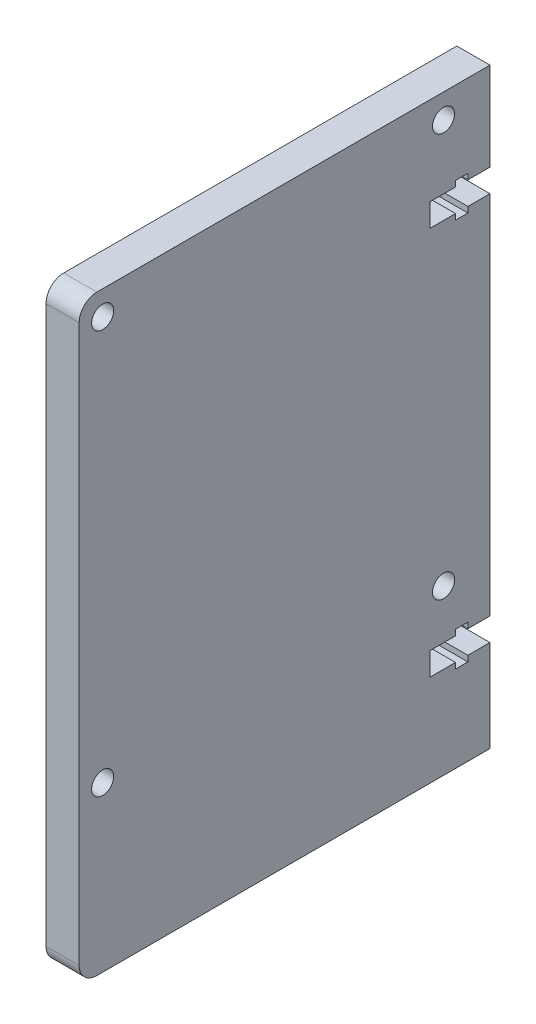
from build123d import *

# Parameters (mm, degrees)
SKETCH1_W           = 59.055
SKETCH1_H           = 85.09
BOSS_EXTRUDE1_DEPTH = 4.7625
CUT_EXTRUDE1_REACH  = 203.148
SKETCH2_R           = 1.5875
CUT_EXTRUDE2_DEPTH  = 202.147856386
FILLET1_R           = 2.54


with BuildPart() as part:
    # Sketch1 → Boss-Extrude1 (new body)
    with BuildSketch(Plane(origin=(0, 0, 0), x_dir=(0, 0, -1), z_dir=(1, 0, 0))):
        with Locations((-162.318935185, 17.727083333)):
            Rectangle(SKETCH1_W, SKETCH1_H)
    extrude(amount=BOSS_EXTRUDE1_DEPTH)

    # Sketch2 → Cut-Extrude1 (cut, up to next)
    with BuildSketch(Plane(origin=(4.7625, 0, 0), x_dir=(0, 0, -1), z_dir=(1, 0, 0)), mode=Mode.PRIVATE) as cut_extrude1_sk1:
        with Locations((-188.466435185, -1.227916667)):
            Circle(SKETCH2_R)
    cut_extrude1_tool1 = extrude(cut_extrude1_sk1.sketch, amount=-CUT_EXTRUDE1_REACH, mode=Mode.PRIVATE) & part.part
    # Sketch2 → Cut-Extrude1 (cut, up to next)
    with BuildSketch(Plane(origin=(4.7625, 0, 0), x_dir=(0, 0, -1), z_dir=(1, 0, 0)), mode=Mode.PRIVATE) as cut_extrude1_sk2:
        with Locations((-139.466435185, -1.227916667)):
            Circle(SKETCH2_R)
    cut_extrude1_tool2 = extrude(cut_extrude1_sk2.sketch, amount=-CUT_EXTRUDE1_REACH, mode=Mode.PRIVATE) & part.part
    # Sketch2 → Cut-Extrude1 (cut, up to next)
    with BuildSketch(Plane(origin=(4.7625, 0, 0), x_dir=(0, 0, -1), z_dir=(1, 0, 0)), mode=Mode.PRIVATE) as cut_extrude1_sk3:
        with Locations((-139.466435185, 56.772083333)):
            Circle(SKETCH2_R)
    cut_extrude1_tool3 = extrude(cut_extrude1_sk3.sketch, amount=-CUT_EXTRUDE1_REACH, mode=Mode.PRIVATE) & part.part
    # Sketch2 → Cut-Extrude1 (cut, up to next)
    with BuildSketch(Plane(origin=(4.7625, 0, 0), x_dir=(0, 0, -1), z_dir=(1, 0, 0)), mode=Mode.PRIVATE) as cut_extrude1_sk4:
        with Locations((-188.466435185, 56.772083333)):
            Circle(SKETCH2_R)
    cut_extrude1_tool4 = extrude(cut_extrude1_sk4.sketch, amount=-CUT_EXTRUDE1_REACH, mode=Mode.PRIVATE) & part.part
    add(cut_extrude1_tool1.solids().sort_by_distance((4.7625, -1.227917, 188.466435))[0], mode=Mode.SUBTRACT)
    add(cut_extrude1_tool2.solids().sort_by_distance((4.7625, -1.227917, 139.466435))[0], mode=Mode.SUBTRACT)
    add(cut_extrude1_tool3.solids().sort_by_distance((4.7625, 56.772083, 139.466435))[0], mode=Mode.SUBTRACT)
    add(cut_extrude1_tool4.solids().sort_by_distance((4.7625, 56.772083, 188.466435))[0], mode=Mode.SUBTRACT)

    # Sketch3 → Cut-Extrude2 (cut, through all)
    with BuildSketch(Plane.ZY):
        Polygon((132.791435185, 47.572083333), (135.966435185, 47.572083333), (135.966435185, 48.397583333), (137.744435185, 48.397583333), (137.744435185, 47.572083333), (141.427435185, 47.572083333), (141.427435185, 44.270083333), (137.744435185, 44.270083333), (137.744435185, 43.444583333), (135.966435185, 43.444583333), (135.966435185, 44.270083333), (132.791435185, 44.270083333), align=None)
        Polygon((132.791435185, -8.307916667), (135.966435185, -8.307916667), (135.966435185, -7.482416667), (137.744435185, -7.482416667), (137.744435185, -8.307916667), (141.427435185, -8.307916667), (141.427435185, -11.609916667), (137.744435185, -11.609916667), (137.744435185, -12.435416667), (135.966435185, -12.435416667), (135.966435185, -11.609916667), (132.791435185, -11.609916667), align=None)
    extrude(amount=-CUT_EXTRUDE2_DEPTH, mode=Mode.SUBTRACT)

    # Fillet1
    fillet1_edges = [part.edges().sort_by_distance(p)[0] for p in [
        (2.38125, -24.817916667, 191.846435185),
        (2.38125, 60.272083333, 191.846435185),
    ]]
    fillet(fillet1_edges, radius=FILLET1_R)


solid = part.part
